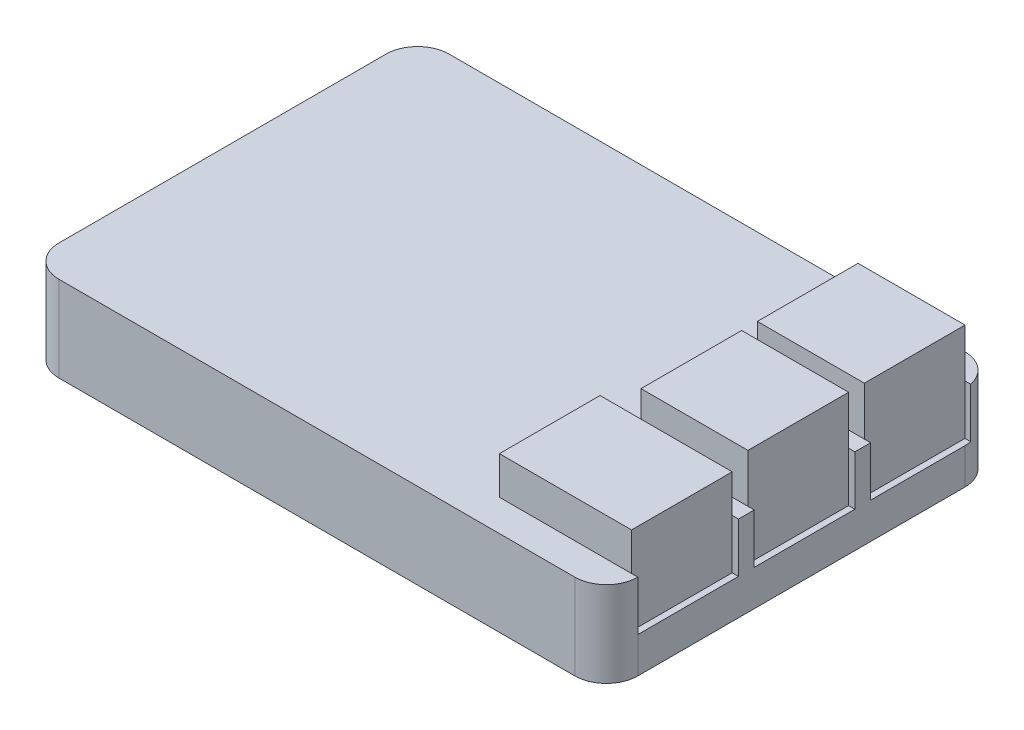
from build123d import *

# Parameters (mm, degrees)
EXTRUDE_1_DEPTH     = 13.6
SKETCH_3_W          = 16
SKETCH_3_H          = 7.9
CUT_EXTRUDE_3_DEPTH = 1
SKETCH_5_W          = 21
SKETCH_5_H          = 16
EXTRUDE_2_DEPTH     = 6
SKETCH_5_4_W        = 17
SKETCH_5_4_H        = 16
EXTRUDE_3_DEPTH     = 7.7


with BuildPart() as part:
    # Эскиз1 → Бобышка-Вытянуть1 (new body)
    with BuildSketch(Plane(origin=(0, 0, 0), x_dir=(1, 0, 0), z_dir=(0, 1, 0))):
        with BuildLine():
            Line((41, 31), (-41, 31))
            ThreePointArc((-41, 31), (-44.535533906, 29.535533906), (-46, 26))
            Line((-46, 26), (-46, -26))
            ThreePointArc((-46, -26), (-44.535533906, -29.535533906), (-41, -31))
            Line((-41, -31), (41, -31))
            ThreePointArc((41, -31), (44.535533906, -29.535533906), (46, -26))
            Line((46, -26), (46, 26))
            ThreePointArc((46, 26), (44.535533906, 29.535533906), (41, 31))
        make_face()
    extrude(amount=EXTRUDE_1_DEPTH)

    # Эскиз3 → Вырез-Вытянуть3 (cut)
    with BuildSketch(Plane(origin=(46, 0, 0), x_dir=(0, 0, -1), z_dir=(1, 0, 0))):
        with Locations((-18, 9.65)):
            Rectangle(SKETCH_3_W, SKETCH_3_H)
        with Locations((0.5, 9.65)):
            Rectangle(SKETCH_3_W, SKETCH_3_H)
        with Locations((19, 9.65)):
            Rectangle(SKETCH_3_W, SKETCH_3_H)
    extrude(amount=-CUT_EXTRUDE_3_DEPTH, mode=Mode.SUBTRACT)

    # Эскиз5 → Бобышка-Вытянуть2 (add)
    with BuildSketch(Plane(origin=(0, 13.6, 0), x_dir=(1, 0, 0), z_dir=(0, 1, 0))):
        with Locations((34.5, -18)):
            Rectangle(SKETCH_5_W, SKETCH_5_H)
    extrude(amount=EXTRUDE_2_DEPTH)

    # Эскиз5<4> → Бобышка-Вытянуть3 (add)
    with BuildSketch(Plane(origin=(0, 13.6, 0), x_dir=(1, 0, 0), z_dir=(0, 1, 0))):
        with Locations((36.5, 0.5)):
            Rectangle(SKETCH_5_4_W, SKETCH_5_4_H)
        with Locations((36.5, 19)):
            Rectangle(SKETCH_5_4_W, SKETCH_5_4_H)
    extrude(amount=EXTRUDE_3_DEPTH)


solid = part.part
